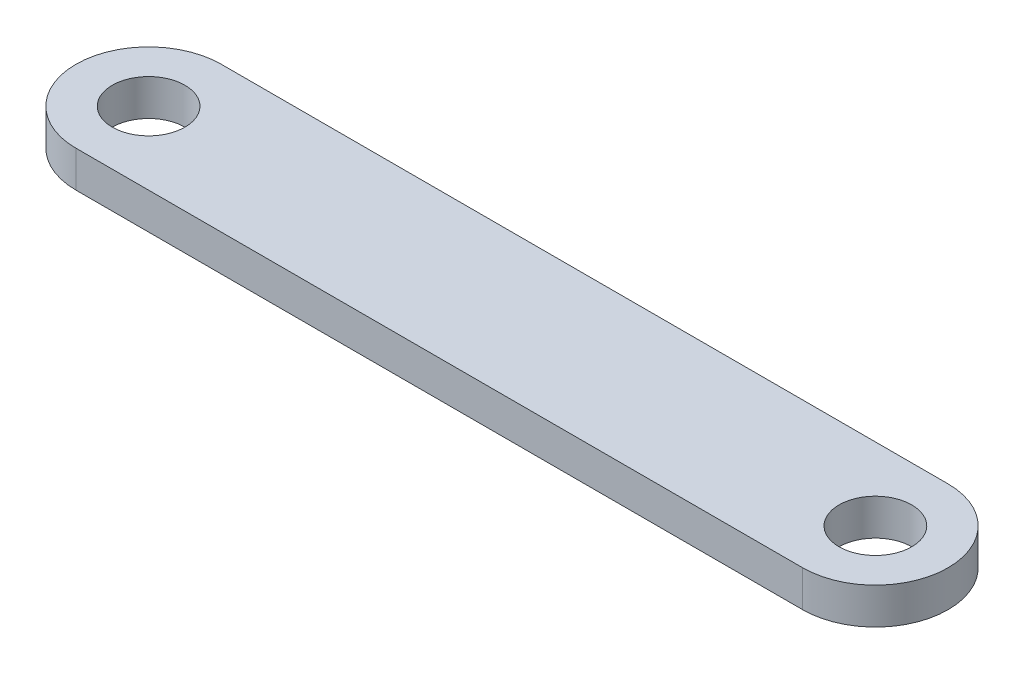
from build123d import *

# Parameters (mm, degrees)
SKETCH1_R           = 5
BOSS_EXTRUDE1_DEPTH = 5


with BuildPart() as part:
    # Sketch1 → Boss-Extrude1 (new body)
    with BuildSketch(Plane(origin=(0, 0, 0), x_dir=(1, 0, 0), z_dir=(0, 1, 0))):
        with BuildLine():
            Line((-50, 10), (50, 10))
            ThreePointArc((50, 10), (60, 0), (50, -10))
            Line((50, -10), (-50, -10))
            ThreePointArc((-50, -10), (-60, 0), (-50, 10))
        make_face()
        with Locations(Location((-50, 0, 0), (0, 0, 270))):
            Circle(SKETCH1_R, mode=Mode.SUBTRACT)
        with Locations(Location((50, 0, 0), (0, 0, 270))):
            Circle(SKETCH1_R, mode=Mode.SUBTRACT)
    extrude(amount=BOSS_EXTRUDE1_DEPTH)


solid = part.part
